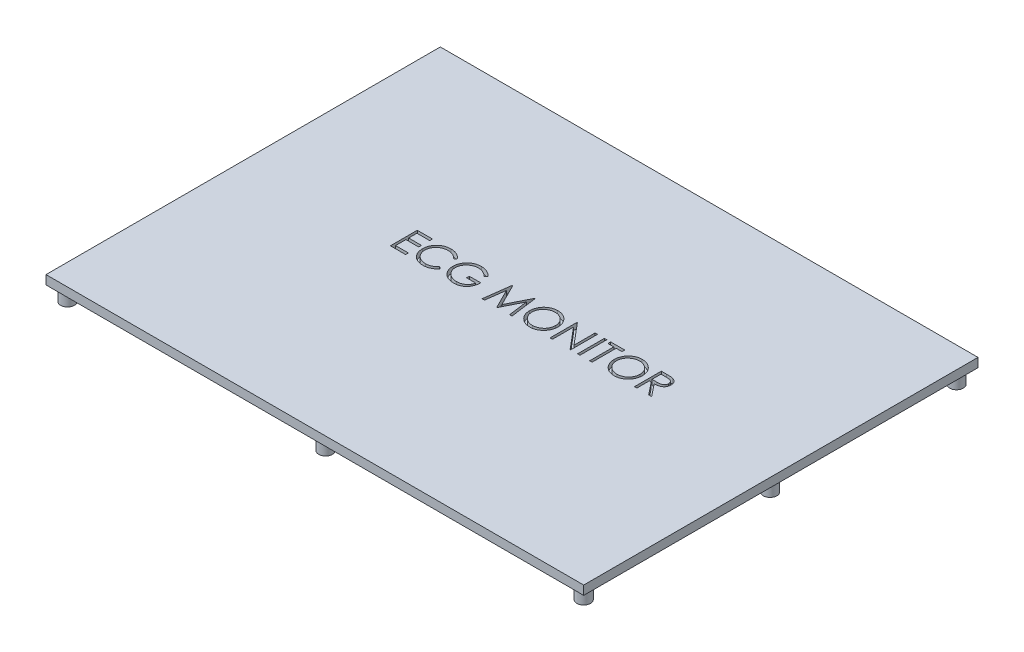
from build123d import *

# Parameters (mm, degrees)
SKETCH1_W           = 150
SKETCH1_H           = 110
BOSS_EXTRUDE1_DEPTH = 2.5
SKETCH2_R           = 1.9
BOSS_EXTRUDE2_DEPTH = 4
SKETCH3_W           = 0.673076923
SKETCH3_H           = 7.5
CUT_EXTRUDE1_DEPTH  = 1.5


with BuildPart() as part:
    # Sketch1 → Boss-Extrude1 (new body)
    with BuildSketch(Plane(origin=(0, 0, 0), x_dir=(1, 0, 0), z_dir=(0, 1, 0))):
        Rectangle(SKETCH1_W, SKETCH1_H)
    extrude(amount=BOSS_EXTRUDE1_DEPTH)

    # Sketch2 → Boss-Extrude2 (add)
    with BuildSketch(Plane.XZ):
        with Locations(Location((-72, 52, 0), (0, 0, 90))):
            Circle(SKETCH2_R)
        with Locations(Location((0, 52, 0), (0, 0, 90))):
            Circle(SKETCH2_R)
        with Locations(Location((72, 52, 0), (0, 0, 90))):
            Circle(SKETCH2_R)
        with Locations(Location((72, 0, 0), (0, 0, 90))):
            Circle(SKETCH2_R)
        with Locations(Location((72, -52, 0), (0, 0, 90))):
            Circle(SKETCH2_R)
        with Locations(Location((0, -52, 0), (0, 0, 90))):
            Circle(SKETCH2_R)
        with Locations(Location((-72, -52, 0), (0, 0, 90))):
            Circle(SKETCH2_R)
        with Locations(Location((-72, 0, 0), (0, 0, 90))):
            Circle(SKETCH2_R)
    extrude(amount=BOSS_EXTRUDE2_DEPTH)

    # Sketch3 → Cut-Extrude1 (cut)
    # profile 1 of 10: a face of its own
    with BuildSketch(Plane(origin=(0, 2.5, 0), x_dir=(1, 0, 0), z_dir=(0, 1, 0))):
        Polygon((-33.920536471, 7.5), (-29.68976724, 7.5), (-29.68976724, 6.730769231), (-33.247459547, 6.730769231), (-33.247459547, 4.423076923), (-29.68976724, 4.423076923), (-29.68976724, 3.653846154), (-33.247459547, 3.653846154), (-33.247459547, 0.769230769), (-29.68976724, 0.769230769), (-29.68976724, 0), (-33.920536471, 0), align=None)
    # profile 2 of 10: a face of its own
    with BuildSketch(Plane(origin=(0, 2.5, 0), x_dir=(1, 0, 0), z_dir=(0, 1, 0))):
        with BuildLine():
            Line((-21.420536471, 6.123798077), (-22.009478778, 5.673076923))
            add(Edge.make_bspline(
                [(-22.009478778, 5.673076923), (-22.051491396, 5.723146858), (-22.134950211, 5.822611678), (-22.26921993, 5.96228213), (-22.409152022, 6.093136262), (-22.554692996, 6.215797433), (-22.708462538, 6.325976216), (-22.866735678, 6.429414294), (-23.032160061, 6.522130875), (-23.260913778, 6.63455156), (-23.560159167, 6.751864749), (-23.936862394, 6.850228816), (-24.330100462, 6.912845621), (-24.598381032, 6.919627424), (-24.734839355, 6.923076923)],
                knots=[0, 0, 0, 0, 0.757959112, 1.505699292, 2.245454638, 2.979532153, 3.711538275, 4.438200793, 5.171680507, 5.909471876, 7.393775596, 8.890124382, 10.418191784, 12, 12, 12, 12], degree=3))
            add(Edge.make_bspline(
                [(-24.734839355, 6.923076923), (-24.810017854, 6.922211289), (-24.959677124, 6.920488055), (-25.181780995, 6.897754215), (-25.399737533, 6.865801622), (-25.613404961, 6.818390216), (-25.822511301, 6.758448889), (-26.028423591, 6.686823002), (-26.22816059, 6.598205488), (-26.424485387, 6.500259217), (-26.612583696, 6.389628978), (-26.790558798, 6.26895751), (-26.957761587, 6.13959516), (-27.114324327, 6.001057075), (-27.260407073, 5.85396716), (-27.394951311, 5.696757856), (-27.517491476, 5.52993177), (-27.630456529, 5.355688754), (-27.731626672, 5.174536343), (-27.816333557, 4.98580405), (-27.891344533, 4.792723829), (-27.950700053, 4.593114198), (-27.99768116, 4.3883797), (-28.030097582, 4.177970869), (-28.052572877, 3.96232727), (-28.054287542, 3.816164457), (-28.055151855, 3.742487981)],
                knots=[0, 0, 0, 0, 1.054917814, 2.100044995, 3.131103042, 4.146048494, 5.169673617, 6.183595914, 7.203665975, 8.234915748, 9.262203917, 10.264457458, 11.251630812, 12.227803204, 13.197192746, 14.159520551, 15.12972552, 16.100847026, 17.073214652, 18.039054194, 19.002613845, 19.979014051, 20.95965708, 21.949030935, 22.966165397, 24, 24, 24, 24], degree=3))
            add(Edge.make_bspline(
                [(-28.055151855, 3.742487981), (-28.052447957, 3.631635152), (-28.047139212, 3.413990328), (-27.999892782, 3.095196162), (-27.928096158, 2.789794718), (-27.82049135, 2.499695056), (-27.68780767, 2.221320003), (-27.520149217, 1.959379603), (-27.325970923, 1.709915536), (-27.102525738, 1.478823505), (-26.857370418, 1.267722666), (-26.594339179, 1.081828562), (-26.314087134, 0.9268681), (-26.019708641, 0.797919643), (-25.708938397, 0.698798084), (-25.382335249, 0.629017819), (-25.040609544, 0.583498861), (-24.807103688, 0.579140958), (-24.688264836, 0.576923077)],
                knots=[0, 0, 0, 0, 1.029171465, 2.020641659, 2.987623507, 3.938342917, 4.889210282, 5.84687017, 6.821220943, 7.821438502, 8.827599549, 9.822697543, 10.807740252, 11.797342354, 12.80366471, 13.83203677, 14.896651826, 16, 16, 16, 16], degree=3))
            add(Edge.make_bspline(
                [(-24.688264836, 0.576923077), (-24.557330502, 0.580541891), (-24.299620412, 0.587664582), (-23.921688927, 0.64800583), (-23.559898, 0.745844225), (-23.214228172, 0.882768345), (-22.88565393, 1.06076539), (-22.573661087, 1.276546556), (-22.277986293, 1.532164412), (-22.100190688, 1.727342544), (-22.009478778, 1.826923077)],
                knots=[0, 0, 0, 0, 1.028121516, 2.023589091, 2.998037872, 3.967518031, 4.937445131, 5.927275754, 6.942489185, 8, 8, 8, 8], degree=3))
            Line((-22.009478778, 1.826923077), (-21.420536471, 1.380709135))
            add(Edge.make_bspline(
                [(-21.420536471, 1.380709135), (-21.46793242, 1.319555309), (-21.562497296, 1.197540581), (-21.715621618, 1.025529775), (-21.876930112, 0.863735413), (-22.04762092, 0.713461939), (-22.225730473, 0.57170237), (-22.414456857, 0.44248416), (-22.611319069, 0.324003694), (-22.815650095, 0.215517427), (-23.027232837, 0.119266183), (-23.245813769, 0.036865252), (-23.470450717, -0.034116654), (-23.701153949, -0.092513661), (-23.938401999, -0.138094555), (-24.181338729, -0.168565287), (-24.430488462, -0.189440818), (-24.598577222, -0.191343495), (-24.683757624, -0.192307692)],
                knots=[0, 0, 0, 0, 0.986787822, 1.968848986, 2.935600012, 3.899624008, 4.868462664, 5.837806735, 6.815139263, 7.798259679, 8.787526145, 9.778297419, 10.776456485, 11.791383307, 12.812564526, 13.85620153, 14.913611965, 16, 16, 16, 16], degree=3))
            add(Edge.make_bspline(
                [(-24.683757624, -0.192307692), (-24.764422625, -0.19174628), (-24.923927675, -0.190636156), (-25.159425, -0.17265294), (-25.388688388, -0.148117789), (-25.611062586, -0.111174651), (-25.827761104, -0.067579637), (-26.036819499, -0.00914123), (-26.24029495, 0.05632127), (-26.437369966, 0.133260527), (-26.62821218, 0.220080918), (-26.812206061, 0.318205687), (-26.989266988, 0.426809683), (-27.161135747, 0.543498991), (-27.325273426, 0.672021781), (-27.483102409, 0.810593141), (-27.635507715, 0.958746021), (-27.729799183, 1.065577849), (-27.777207144, 1.119290865)],
                knots=[0, 0, 0, 0, 1.114604814, 2.203992996, 3.262667896, 4.300477797, 5.318619304, 6.316056647, 7.298880507, 8.271930387, 9.238335007, 10.195173496, 11.151986948, 12.108099108, 13.064862484, 14.031167946, 15.010108607, 16, 16, 16, 16], degree=3))
            add(Edge.make_bspline(
                [(-27.777207144, 1.119290865), (-27.853140665, 1.212593413), (-28.004090973, 1.398072078), (-28.197217438, 1.698684895), (-28.362533627, 2.012545343), (-28.496196315, 2.341302333), (-28.600687886, 2.684218163), (-28.673076161, 3.041465694), (-28.720115313, 3.412711284), (-28.725494504, 3.665218688), (-28.728228778, 3.793569712)],
                knots=[0, 0, 0, 0, 0.994628077, 1.977248131, 2.950237994, 3.925870899, 4.908910175, 5.911660606, 6.938484602, 8, 8, 8, 8], degree=3))
            add(Edge.make_bspline(
                [(-28.728228778, 3.793569712), (-28.724896221, 3.928474255), (-28.718339622, 4.193890522), (-28.662634346, 4.583406136), (-28.573022639, 4.956587705), (-28.445743592, 5.312738586), (-28.284374982, 5.653732044), (-28.085032239, 5.976963197), (-27.850031219, 6.284499196), (-27.581215003, 6.571673663), (-27.286427856, 6.83425799), (-26.970744683, 7.065271284), (-26.634783368, 7.257523104), (-26.282245115, 7.418229167), (-25.910490083, 7.541753016), (-25.520311435, 7.62822413), (-25.112442332, 7.682046522), (-24.834165705, 7.688850539), (-24.692772047, 7.692307692)],
                knots=[0, 0, 0, 0, 1.032925535, 2.032216505, 3.007276963, 3.968222605, 4.92396291, 5.891752235, 6.871517503, 7.883894988, 8.900124299, 9.891468569, 10.874487609, 11.85992873, 12.854644235, 13.869047385, 14.917252991, 16, 16, 16, 16], degree=3))
            add(Edge.make_bspline(
                [(-24.692772047, 7.692307692), (-24.606598179, 7.691274539), (-24.436025685, 7.689229516), (-24.183698572, 7.669287783), (-23.938036443, 7.636044341), (-23.698870053, 7.59079562), (-23.465035876, 7.534637074), (-23.238321074, 7.461479292), (-23.017395316, 7.377829582), (-22.803651942, 7.281490012), (-22.598116477, 7.173346995), (-22.400852937, 7.05459923), (-22.21342824, 6.925393933), (-22.034523565, 6.786829985), (-21.867131684, 6.63597593), (-21.706499944, 6.476981081), (-21.558083348, 6.305265744), (-21.466469359, 6.184398028), (-21.420536471, 6.123798077)],
                knots=[0, 0, 0, 0, 1.096760587, 2.17092713, 3.219439832, 4.250915756, 5.268269357, 6.278326846, 7.281116186, 8.274029601, 9.260640565, 10.235837813, 11.203064059, 12.156899882, 13.114053108, 14.069676657, 15.032185724, 16, 16, 16, 16], degree=3))
        make_face()
    # profile 3 of 10: a face of its own
    with BuildSketch(Plane(origin=(0, 2.5, 0), x_dir=(1, 0, 0), z_dir=(0, 1, 0))):
        with BuildLine():
            Line((-12.862844163, 6.219951923), (-13.43976724, 5.673076923))
            add(Edge.make_bspline(
                [(-13.43976724, 5.673076923), (-13.544164857, 5.771285915), (-13.750470671, 5.96536205), (-14.086814048, 6.217171325), (-14.437736121, 6.432884397), (-14.801405757, 6.608397761), (-15.168816944, 6.748439391), (-15.535092893, 6.848142548), (-15.896476539, 6.911726557), (-16.136834864, 6.919330206), (-16.255272047, 6.923076923)],
                knots=[0, 0, 0, 0, 1.08915593, 2.152340314, 3.188132944, 4.216796309, 5.218260357, 6.173443236, 7.099959455, 8, 8, 8, 8], degree=3))
            add(Edge.make_bspline(
                [(-16.255272047, 6.923076923), (-16.327946404, 6.922190625), (-16.473106634, 6.920420327), (-16.688725086, 6.89782558), (-16.902082165, 6.865329442), (-17.112775111, 6.818311133), (-17.321213582, 6.758720291), (-17.526672637, 6.684180013), (-17.72953554, 6.597275918), (-17.927891428, 6.496856332), (-18.120192507, 6.386542375), (-18.301814297, 6.264295502), (-18.473914438, 6.13403381), (-18.633258206, 5.992495996), (-18.780762178, 5.840964142), (-18.91993726, 5.682257058), (-19.045888609, 5.512038732), (-19.159655391, 5.333440962), (-19.261144573, 5.149600557), (-19.350734545, 4.962287007), (-19.425942591, 4.772121605), (-19.485448567, 4.578865724), (-19.534542825, 4.38401446), (-19.569080555, 4.186218631), (-19.588552102, 3.985266448), (-19.591920202, 3.850700894), (-19.593613394, 3.783052885)],
                knots=[0, 0, 0, 0, 1.02818874, 2.053710826, 3.065248034, 4.081641283, 5.106893873, 6.131558223, 7.173050175, 8.228653731, 9.27666206, 10.308777013, 11.325269123, 12.329503258, 13.32196095, 14.316845687, 15.314881793, 16.315733098, 17.311955233, 18.285320748, 19.252783886, 20.203351036, 21.145449891, 22.095197417, 23.042428769, 24, 24, 24, 24], degree=3))
            add(Edge.make_bspline(
                [(-19.593613394, 3.783052885), (-19.591993997, 3.713901133), (-19.588759627, 3.575786461), (-19.568058942, 3.369656306), (-19.529641284, 3.166587586), (-19.478281908, 2.965913016), (-19.414037303, 2.767288913), (-19.333953018, 2.571576392), (-19.23909816, 2.378782696), (-19.129305549, 2.190644946), (-19.008906541, 2.007381324), (-18.87402851, 1.834753778), (-18.730755832, 1.670463541), (-18.573868903, 1.518158333), (-18.408398456, 1.373764269), (-18.229400721, 1.241259579), (-18.040395449, 1.118091958), (-17.841094281, 1.005813702), (-17.633659747, 0.905509697), (-17.420966705, 0.816315634), (-17.202335671, 0.742859911), (-16.978915622, 0.682992545), (-16.750972897, 0.63392048), (-16.517350462, 0.602350879), (-16.279766087, 0.579441956), (-16.119611876, 0.577766949), (-16.038925894, 0.576923077)],
                knots=[0, 0, 0, 0, 0.93586088, 1.869166235, 2.799637598, 3.729985548, 4.670839027, 5.622275134, 6.589130586, 7.576015415, 8.568469353, 9.55398029, 10.53834874, 11.515998671, 12.510579167, 13.508179873, 14.527009472, 15.561807829, 16.601455013, 17.643573243, 18.680854198, 19.719860599, 20.772568776, 21.833555941, 22.908541556, 24, 24, 24, 24], degree=3))
            add(Edge.make_bspline(
                [(-16.038925894, 0.576923077), (-15.941686578, 0.57895574), (-15.750741384, 0.582947206), (-15.47005615, 0.614019254), (-15.200478141, 0.662548098), (-14.942764848, 0.733617876), (-14.696616947, 0.824268609), (-14.461132072, 0.933544437), (-14.238164232, 1.065636706), (-14.027043146, 1.214723564), (-13.832563463, 1.380826777), (-13.657161769, 1.560064895), (-13.50363572, 1.751567895), (-13.369697079, 1.954207856), (-13.25889282, 2.169662081), (-13.167943973, 2.396874715), (-13.098229777, 2.635947955), (-13.069611974, 2.801144309), (-13.055151855, 2.884615385)],
                knots=[0, 0, 0, 0, 1.13008108, 2.219097802, 3.278683437, 4.311054135, 5.322181354, 6.324827112, 7.324222904, 8.330512327, 9.32562643, 10.293043162, 11.24128371, 12.174520618, 13.111833804, 14.052305215, 15.015860969, 16, 16, 16, 16], degree=3))
            Line((-13.055151855, 2.884615385), (-15.555151855, 2.884615385))
            Line((-15.555151855, 2.884615385), (-15.555151855, 3.653846154))
            Line((-15.555151855, 3.653846154), (-12.382074932, 3.653846154))
            add(Edge.make_bspline(
                [(-12.382074932, 3.653846154), (-12.385730321, 3.510472964), (-12.392884579, 3.229865731), (-12.443067969, 2.820643722), (-12.524103353, 2.434132951), (-12.634804021, 2.069926369), (-12.778108193, 1.728540099), (-12.952477897, 1.409627528), (-13.160703871, 1.115248926), (-13.395369103, 0.843001061), (-13.658726155, 0.60015275), (-13.943658912, 0.386711454), (-14.25063813, 0.206920135), (-14.579373432, 0.060647287), (-14.928788646, -0.053511273), (-15.299692317, -0.134450366), (-15.691581462, -0.182943145), (-15.960160055, -0.189138958), (-16.097519644, -0.192307692)],
                knots=[0, 0, 0, 0, 1.140356446, 2.231883559, 3.274166699, 4.278491846, 5.25512956, 6.21435461, 7.1637429, 8.11826594, 9.068280886, 10.0076534, 10.945064095, 11.891975133, 12.864533718, 13.863980011, 14.907571808, 16, 16, 16, 16], degree=3))
            add(Edge.make_bspline(
                [(-16.097519644, -0.192307692), (-16.182184219, -0.191088147), (-16.34917005, -0.18868281), (-16.595793467, -0.171588494), (-16.83561694, -0.145272973), (-17.06860553, -0.105533423), (-17.295616263, -0.056859164), (-17.515515374, 0.005469519), (-17.729140536, 0.077616732), (-17.936821933, 0.159678889), (-18.136674534, 0.254761011), (-18.329588499, 0.360424524), (-18.516630197, 0.476124583), (-18.69652555, 0.603862109), (-18.870211882, 0.742681667), (-19.036569261, 0.892861493), (-19.196529, 1.053942464), (-19.296729993, 1.168326056), (-19.347219163, 1.225961538)],
                knots=[0, 0, 0, 0, 1.107784379, 2.184907829, 3.233506516, 4.263428166, 5.276301166, 6.270063455, 7.25232949, 8.225834625, 9.190232166, 10.146266622, 11.1027726, 12.066435141, 13.031522626, 14.010570082, 14.99756817, 16, 16, 16, 16], degree=3))
            add(Edge.make_bspline(
                [(-19.347219163, 1.225961538), (-19.420474731, 1.317398652), (-19.565769901, 1.498755117), (-19.752794523, 1.789326427), (-19.9122261, 2.090187556), (-20.041585719, 2.402176045), (-20.142595904, 2.725000073), (-20.215037874, 3.058247125), (-20.257482065, 3.402346334), (-20.263596788, 3.635200472), (-20.266690317, 3.753004808)],
                knots=[0, 0, 0, 0, 1.023165419, 2.029347347, 3.013907458, 3.994755782, 4.975994455, 5.96558838, 6.970761222, 8, 8, 8, 8], degree=3))
            add(Edge.make_bspline(
                [(-20.266690317, 3.753004808), (-20.265549806, 3.841218206), (-20.263283281, 4.016523865), (-20.235800032, 4.276789524), (-20.196368422, 4.532433864), (-20.138410448, 4.783247913), (-20.065347024, 5.029399182), (-19.974160982, 5.271001961), (-19.867993348, 5.508198829), (-19.744595856, 5.739357118), (-19.607272014, 5.961409431), (-19.458235828, 6.173461866), (-19.29537097, 6.37165272), (-19.121337114, 6.558491966), (-18.934057849, 6.731632353), (-18.735287656, 6.892676876), (-18.52487335, 7.041841559), (-18.302152964, 7.17677692), (-18.070450783, 7.297984678), (-17.830322209, 7.404247274), (-17.581840542, 7.492068665), (-17.326867376, 7.566583907), (-17.063472732, 7.621687779), (-16.79356801, 7.661649377), (-16.515746341, 7.688993519), (-16.32795485, 7.691192638), (-16.23273599, 7.692307692)],
                knots=[0, 0, 0, 0, 1.008945113, 2.00506715, 2.99143336, 3.967273523, 4.948097931, 5.927297278, 6.919902385, 7.919676788, 8.923139349, 9.905703106, 10.883022732, 11.856032218, 12.825136022, 13.798837087, 14.781400844, 15.773989409, 16.776158564, 17.77167057, 18.775803737, 19.789618931, 20.80898985, 21.851988756, 22.910860228, 24, 24, 24, 24], degree=3))
            add(Edge.make_bspline(
                [(-16.23273599, 7.692307692), (-16.15508261, 7.691065924), (-16.001105085, 7.688603644), (-15.771978515, 7.671536541), (-15.546393484, 7.644485367), (-15.324015506, 7.607570825), (-15.105601864, 7.557291488), (-14.890530352, 7.497123735), (-14.678489203, 7.42706983), (-14.470142955, 7.343522302), (-14.264090706, 7.248693105), (-14.059186762, 7.141950057), (-13.856131235, 7.021467905), (-13.654571989, 6.8868889), (-13.453238008, 6.740524433), (-13.255313774, 6.578188382), (-13.056021751, 6.406282477), (-12.927875006, 6.282677797), (-12.862844163, 6.219951923)],
                knots=[0, 0, 0, 0, 0.985871117, 1.954866573, 2.915460327, 3.869826059, 4.81536089, 5.759505086, 6.70452669, 7.649098992, 8.607881297, 9.583363685, 10.581137262, 11.603961102, 12.659522466, 13.73993555, 14.853081303, 16, 16, 16, 16], degree=3))
        make_face()
    # profile 4 of 10: a face of its own
    with BuildSketch(Plane(origin=(0, 2.5, 0), x_dir=(1, 0, 0), z_dir=(0, 1, 0))):
        Polygon((-8.343613394, 0), (-7.353529259, 7.5), (-7.257375413, 7.5), (-4.160921086, 1.346153846), (-1.071978778, 7.5), (-0.974322528, 7.5), (0.021771222, 0), (-0.654310509, 0), (-1.372459547, 5.396634615), (-4.079791278, 0), (-4.231534067, 0), (-6.949382624, 5.408653846), (-7.666029259, 0), align=None)
    # profile 5 of 10: a face of its own
    with BuildSketch(Plane(origin=(0, 2.5, 0), x_dir=(1, 0, 0), z_dir=(0, 1, 0))):
        with BuildLine():
            add(Edge.make_bspline(
                [(5.069848145, 7.692307692), (5.208722658, 7.688790237), (5.481483658, 7.681881663), (5.882358439, 7.62899787), (6.265062215, 7.537507748), (6.632712512, 7.4156585), (6.980911748, 7.253113389), (7.312280803, 7.056645214), (7.626031247, 6.824195659), (7.917934207, 6.557561602), (8.185056244, 6.2674542), (8.420397428, 5.957858679), (8.617630915, 5.63064696), (8.779600459, 5.286802323), (8.906668908, 4.927102391), (8.994352573, 4.549629528), (9.050362895, 4.156829478), (9.056910989, 3.888914768), (9.06023276, 3.753004808)],
                knots=[0, 0, 0, 0, 1.065120563, 2.091984664, 3.0946048, 4.079830382, 5.057816894, 6.036188127, 7.030412546, 8.04752943, 9.064399622, 10.05169764, 11.02544977, 11.989514704, 12.962713494, 13.945757189, 14.957906945, 16, 16, 16, 16], degree=3))
            add(Edge.make_bspline(
                [(9.06023276, 3.753004808), (9.056911476, 3.618095994), (9.050364841, 3.352175093), (8.994288889, 2.961867713), (8.906343889, 2.586673363), (8.780780461, 2.227218393), (8.619583008, 1.883123613), (8.421036212, 1.555294427), (8.187162189, 1.243623359), (7.921004651, 0.95152479), (7.630859561, 0.683673067), (7.319651847, 0.450275477), (6.994380447, 0.249438067), (6.650859644, 0.089187337), (6.293645279, -0.03889535), (5.919540301, -0.126222414), (5.530297685, -0.182551793), (5.26485982, -0.189020041), (5.129944299, -0.192307692)],
                knots=[0, 0, 0, 0, 1.043624062, 2.057103931, 3.04512605, 4.022047818, 4.998200453, 5.980619268, 6.982898556, 8.009068085, 9.034988726, 10.034168286, 11.015286542, 11.987931943, 12.962482838, 13.94673481, 14.956375938, 16, 16, 16, 16], degree=3))
            add(Edge.make_bspline(
                [(5.129944299, -0.192307692), (4.994035044, -0.188987578), (4.726121724, -0.182442748), (4.332828077, -0.126339737), (3.955090054, -0.038608372), (3.593987873, 0.086768991), (3.249320167, 0.248805914), (2.920412847, 0.446386726), (2.608586103, 0.6808306), (2.316425217, 0.946901832), (2.049105507, 1.236555157), (1.816049702, 1.546914275), (1.618424459, 1.871890254), (1.456931604, 2.212384948), (1.329079191, 2.566752326), (1.24185458, 2.937356206), (1.185420397, 3.322083718), (1.178917155, 3.584032786), (1.175617376, 3.716947115)],
                knots=[0, 0, 0, 0, 1.053102029, 2.075944431, 3.073151272, 4.055350789, 5.033113405, 6.020478099, 7.024410459, 8.052272461, 9.079885166, 10.07527673, 11.055994387, 12.023226415, 12.992069828, 13.970394897, 14.97016774, 16, 16, 16, 16], degree=3))
            add(Edge.make_bspline(
                [(1.175617376, 3.716947115), (1.176763023, 3.806159978), (1.179039865, 3.983460242), (1.206450635, 4.246745814), (1.246225709, 4.505797224), (1.303229807, 4.759877827), (1.377783379, 5.008365651), (1.465752009, 5.252974428), (1.573194535, 5.491225265), (1.694653067, 5.724246819), (1.830214084, 5.948406617), (1.979947833, 6.160291438), (2.138595051, 6.361679288), (2.312516609, 6.547351439), (2.49598042, 6.722709274), (2.691962659, 6.885057954), (2.899267468, 7.03586142), (3.118786853, 7.171762151), (3.345111728, 7.294674582), (3.578419109, 7.400149977), (3.815540334, 7.490677252), (4.057586008, 7.564050449), (4.303913376, 7.62197624), (4.555060058, 7.661420569), (4.810825971, 7.688901251), (4.98313594, 7.691167326), (5.069848145, 7.692307692)],
                knots=[0, 0, 0, 0, 1.037015668, 2.060948919, 3.074880161, 4.083647147, 5.086022904, 6.090072063, 7.104153813, 8.122640571, 9.144368836, 10.147691507, 11.138137339, 12.123020368, 13.103399296, 14.087645067, 15.080126199, 16.082011238, 17.087798457, 18.072939717, 19.057185487, 20.037253025, 21.01195951, 21.997135196, 22.992090687, 24, 24, 24, 24], degree=3))
        make_face()
        with BuildLine():
            add(Edge.make_bspline(
                [(5.102901029, 6.923076923), (5.031726815, 6.922209301), (4.890058816, 6.920482352), (4.679449095, 6.89773439), (4.471609237, 6.865313199), (4.266496318, 6.819067083), (4.064968555, 6.756058399), (3.865147467, 6.683542167), (3.668855208, 6.595211258), (3.476739799, 6.495412606), (3.290493209, 6.384950633), (3.114751706, 6.262868275), (2.949060326, 6.132028516), (2.793824755, 5.992126007), (2.649500814, 5.842448289), (2.513247883, 5.685264498), (2.390527351, 5.516081874), (2.278058257, 5.339488145), (2.177412885, 5.155713328), (2.087915697, 4.966692195), (2.014707106, 4.770882866), (1.955002014, 4.570409671), (1.90550242, 4.365590115), (1.874144011, 4.154870438), (1.851146098, 3.939309484), (1.849517858, 3.793634083), (1.848694299, 3.719951923)],
                knots=[0, 0, 0, 0, 1.008559885, 2.007477868, 2.99961109, 3.989939068, 4.984837346, 5.991145699, 7.001802488, 8.033829008, 9.059044045, 10.069351652, 11.065060232, 12.050310815, 13.029377138, 14.011219647, 14.996725999, 15.989392538, 16.977580475, 17.965360261, 18.951710183, 19.937753436, 20.929683414, 21.935841486, 22.955955122, 24, 24, 24, 24], degree=3))
            add(Edge.make_bspline(
                [(1.848694299, 3.719951923), (1.851426146, 3.611604307), (1.856800534, 3.398451028), (1.90385247, 3.08609072), (1.97632813, 2.785901535), (2.083165343, 2.499526015), (2.216773803, 2.224502551), (2.381831425, 1.963270899), (2.577386609, 1.715760454), (2.799522737, 1.483699163), (3.042357108, 1.271886725), (3.300212958, 1.085965135), (3.570327831, 0.928657457), (3.853406123, 0.800503731), (4.147936564, 0.698954292), (4.45581703, 0.629357226), (4.774996587, 0.583552678), (4.992562276, 0.579153916), (5.102901029, 0.576923077)],
                knots=[0, 0, 0, 0, 1.032063989, 2.030389145, 3.003944642, 3.970395727, 4.937377036, 5.913328081, 6.909231446, 7.93887556, 8.970685674, 9.976071282, 10.964166581, 11.944589148, 12.933237628, 13.927779006, 14.949070134, 16, 16, 16, 16], degree=3))
            add(Edge.make_bspline(
                [(5.102901029, 0.576923077), (5.177064247, 0.577942015), (5.324152182, 0.579962875), (5.542928302, 0.600317182), (5.757763041, 0.632956902), (5.968355069, 0.679951164), (6.174465379, 0.738766607), (6.376954243, 0.80864031), (6.573664865, 0.895814318), (6.767078804, 0.992131357), (6.952213607, 1.101931694), (7.128946891, 1.219870586), (7.29282399, 1.350517631), (7.447943429, 1.488341515), (7.592859906, 1.636121189), (7.726593443, 1.793664521), (7.848693726, 1.96196593), (7.961120112, 2.138291799), (8.061412818, 2.322569483), (8.148796602, 2.512275936), (8.222931135, 2.706944028), (8.282777931, 2.906854538), (8.329675349, 3.111627785), (8.361989463, 3.321537953), (8.384593261, 3.536165115), (8.386296997, 3.681330521), (8.387155837, 3.754507212)],
                knots=[0, 0, 0, 0, 1.047197238, 2.076906641, 3.100256066, 4.114471768, 5.12198147, 6.126382909, 7.136867548, 8.15857795, 9.17633901, 10.174870724, 11.156907918, 12.133735059, 13.104061851, 14.077631395, 15.04955518, 16.038496417, 17.029181396, 18.010275684, 18.986308667, 19.968651475, 20.955262928, 21.950658345, 22.966943676, 24, 24, 24, 24], degree=3))
            add(Edge.make_bspline(
                [(8.387155837, 3.754507212), (8.386296309, 3.827183292), (8.384591278, 3.971349685), (8.362000261, 4.18448001), (8.32964121, 4.392879749), (8.283006835, 4.595730756), (8.222899363, 4.793084738), (8.148783655, 4.98475634), (8.061386585, 5.171459615), (7.961083247, 5.352733109), (7.848335054, 5.526678976), (7.725133104, 5.69296986), (7.589350215, 5.848482877), (7.444865876, 5.997057222), (7.288071122, 6.135524128), (7.119676206, 6.263929529), (6.941725468, 6.38537226), (6.753309963, 6.494927035), (6.558858634, 6.596100391), (6.359328724, 6.682781112), (6.156980653, 6.756435654), (5.952328984, 6.819257722), (5.743651173, 6.865132072), (5.532357254, 6.897763607), (5.318739557, 6.920474434), (5.175075515, 6.922206674), (5.102901029, 6.923076923)],
                knots=[0, 0, 0, 0, 1.02996197, 2.043119294, 3.035359645, 4.018872909, 4.991431989, 5.957985074, 6.929999688, 7.912076566, 8.892894881, 9.867085534, 10.843653904, 11.817741046, 12.803660682, 13.806313499, 14.818574707, 15.856120519, 16.894564902, 17.924820532, 18.937903209, 19.946497019, 20.957711757, 21.963978472, 22.977135795, 24, 24, 24, 24], degree=3))
        make_face(mode=Mode.SUBTRACT)
    # profile 6 of 10: a face of its own
    with BuildSketch(Plane(origin=(0, 2.5, 0), x_dir=(1, 0, 0), z_dir=(0, 1, 0))):
        Polygon((10.598694299, 0), (10.598694299, 7.5), (10.73992026, 7.5), (15.694848145, 1.597055288), (15.694848145, 7.5), (16.367925068, 7.5), (16.367925068, 0), (16.214679876, 0), (11.271771222, 5.889423077), (11.271771222, 0), align=None)
    # profile 7 of 10: a face of its own
    with BuildSketch(Plane(origin=(0, 2.5, 0), x_dir=(1, 0, 0), z_dir=(0, 1, 0))):
        with Locations((18.627540452, 3.75)):
            Rectangle(SKETCH3_W, SKETCH3_H)
    # profile 8 of 10: a face of its own
    with BuildSketch(Plane(origin=(0, 2.5, 0), x_dir=(1, 0, 0), z_dir=(0, 1, 0))):
        Polygon((20.021771222, 6.730769231), (20.021771222, 7.5), (23.964078914, 7.5), (23.964078914, 6.730769231), (22.329463529, 6.730769231), (22.329463529, 0), (21.656386606, 0), (21.656386606, 6.730769231), align=None)
    # profile 9 of 10: a face of its own
    with BuildSketch(Plane(origin=(0, 2.5, 0), x_dir=(1, 0, 0), z_dir=(0, 1, 0))):
        with BuildLine():
            add(Edge.make_bspline(
                [(28.627540453, 7.692307692), (28.766414965, 7.688790237), (29.039175966, 7.681881663), (29.440050747, 7.62899787), (29.822754522, 7.537507748), (30.19040482, 7.4156585), (30.538604055, 7.253113389), (30.869973111, 7.056645214), (31.183723554, 6.824195659), (31.475626515, 6.557561602), (31.742748551, 6.2674542), (31.978089736, 5.957858679), (32.175323223, 5.63064696), (32.337292767, 5.286802323), (32.464361216, 4.927102391), (32.552044881, 4.549629528), (32.608055203, 4.156829478), (32.614603297, 3.888914768), (32.617925068, 3.753004808)],
                knots=[0, 0, 0, 0, 1.065120563, 2.091984664, 3.0946048, 4.079830382, 5.057816894, 6.036188127, 7.030412546, 8.04752943, 9.064399622, 10.05169764, 11.02544977, 11.989514704, 12.962713494, 13.945757189, 14.957906945, 16, 16, 16, 16], degree=3))
            add(Edge.make_bspline(
                [(32.617925068, 3.753004808), (32.614603784, 3.618095994), (32.608057148, 3.352175093), (32.551981197, 2.961867713), (32.464036197, 2.586673363), (32.338472769, 2.227218393), (32.177275315, 1.883123613), (31.97872852, 1.555294427), (31.744854497, 1.243623359), (31.478696959, 0.95152479), (31.188551869, 0.683673067), (30.877344154, 0.450275477), (30.552072755, 0.249438067), (30.208551951, 0.089187337), (29.851337587, -0.03889535), (29.477232609, -0.126222414), (29.087989993, -0.182551793), (28.822552128, -0.189020041), (28.687636606, -0.192307692)],
                knots=[0, 0, 0, 0, 1.043624062, 2.057103931, 3.04512605, 4.022047818, 4.998200453, 5.980619268, 6.982898556, 8.009068085, 9.034988726, 10.034168286, 11.015286542, 11.987931943, 12.962482838, 13.94673481, 14.956375938, 16, 16, 16, 16], degree=3))
            add(Edge.make_bspline(
                [(28.687636606, -0.192307692), (28.551727351, -0.188987578), (28.283814032, -0.182442748), (27.890520384, -0.126339737), (27.512782362, -0.038608372), (27.151680181, 0.086768991), (26.807012474, 0.248805914), (26.478105154, 0.446386726), (26.16627841, 0.6808306), (25.874117525, 0.946901832), (25.606797814, 1.236555157), (25.373742009, 1.546914275), (25.176116767, 1.871890254), (25.014623911, 2.212384948), (24.886771498, 2.566752326), (24.799546888, 2.937356206), (24.743112705, 3.322083718), (24.736609463, 3.584032786), (24.733309683, 3.716947115)],
                knots=[0, 0, 0, 0, 1.053102029, 2.075944431, 3.073151272, 4.055350789, 5.033113405, 6.020478099, 7.024410459, 8.052272461, 9.079885166, 10.07527673, 11.055994387, 12.023226415, 12.992069828, 13.970394897, 14.97016774, 16, 16, 16, 16], degree=3))
            add(Edge.make_bspline(
                [(24.733309683, 3.716947115), (24.734455331, 3.806159978), (24.736732173, 3.983460242), (24.764142943, 4.246745814), (24.803918017, 4.505797224), (24.860922115, 4.759877827), (24.935475687, 5.008365651), (25.023444317, 5.252974428), (25.130886843, 5.491225265), (25.252345374, 5.724246819), (25.387906392, 5.948406617), (25.53764014, 6.160291438), (25.696287359, 6.361679288), (25.870208916, 6.547351439), (26.053672727, 6.722709274), (26.249654966, 6.885057954), (26.456959776, 7.03586142), (26.676479161, 7.171762151), (26.902804036, 7.294674582), (27.136111417, 7.400149977), (27.373232641, 7.490677252), (27.615278315, 7.564050449), (27.861605684, 7.62197624), (28.112752365, 7.661420569), (28.368518279, 7.688901251), (28.540828248, 7.691167326), (28.627540453, 7.692307692)],
                knots=[0, 0, 0, 0, 1.037015668, 2.060948919, 3.074880161, 4.083647147, 5.086022904, 6.090072063, 7.104153813, 8.122640571, 9.144368836, 10.147691507, 11.138137339, 12.123020368, 13.103399296, 14.087645067, 15.080126199, 16.082011238, 17.087798457, 18.072939717, 19.057185487, 20.037253025, 21.01195951, 21.997135196, 22.992090687, 24, 24, 24, 24], degree=3))
        make_face()
        with BuildLine():
            add(Edge.make_bspline(
                [(28.660593337, 6.923076923), (28.589419122, 6.922209301), (28.447751123, 6.920482352), (28.237141403, 6.89773439), (28.029301545, 6.865313199), (27.824188626, 6.819067083), (27.622660863, 6.756058399), (27.422839774, 6.683542167), (27.226547516, 6.595211258), (27.034432106, 6.495412606), (26.848185517, 6.384950633), (26.672444014, 6.262868275), (26.506752634, 6.132028516), (26.351517062, 5.992126007), (26.207193122, 5.842448289), (26.07094019, 5.685264498), (25.948219658, 5.516081874), (25.835750565, 5.339488145), (25.735105193, 5.155713328), (25.645608004, 4.966692195), (25.572399414, 4.770882866), (25.512694322, 4.570409671), (25.463194727, 4.365590115), (25.431836319, 4.154870438), (25.408838405, 3.939309484), (25.407210165, 3.793634083), (25.406386606, 3.719951923)],
                knots=[0, 0, 0, 0, 1.008559885, 2.007477868, 2.99961109, 3.989939068, 4.984837346, 5.991145699, 7.001802488, 8.033829008, 9.059044045, 10.069351652, 11.065060232, 12.050310815, 13.029377138, 14.011219647, 14.996725999, 15.989392538, 16.977580475, 17.965360261, 18.951710183, 19.937753436, 20.929683414, 21.935841486, 22.955955122, 24, 24, 24, 24], degree=3))
            add(Edge.make_bspline(
                [(25.406386606, 3.719951923), (25.409118453, 3.611604307), (25.414492842, 3.398451028), (25.461544778, 3.08609072), (25.534020437, 2.785901535), (25.640857651, 2.499526015), (25.774466111, 2.224502551), (25.939523733, 1.963270899), (26.135078916, 1.715760454), (26.357215045, 1.483699163), (26.600049416, 1.271886725), (26.857905266, 1.085965135), (27.128020139, 0.928657457), (27.411098431, 0.800503731), (27.705628871, 0.698954292), (28.013509338, 0.629357226), (28.332688894, 0.583552678), (28.550254584, 0.579153916), (28.660593337, 0.576923077)],
                knots=[0, 0, 0, 0, 1.032063989, 2.030389145, 3.003944642, 3.970395727, 4.937377036, 5.913328081, 6.909231446, 7.93887556, 8.970685674, 9.976071282, 10.964166581, 11.944589148, 12.933237628, 13.927779006, 14.949070134, 16, 16, 16, 16], degree=3))
            add(Edge.make_bspline(
                [(28.660593337, 0.576923077), (28.734756555, 0.577942015), (28.88184449, 0.579962875), (29.100620609, 0.600317182), (29.315455349, 0.632956902), (29.526047377, 0.679951164), (29.732157687, 0.738766607), (29.934646551, 0.80864031), (30.131357173, 0.895814318), (30.324771111, 0.992131357), (30.509905915, 1.101931694), (30.686639198, 1.219870586), (30.850516298, 1.350517631), (31.005635737, 1.488341515), (31.150552213, 1.636121189), (31.284285751, 1.793664521), (31.406386034, 1.96196593), (31.51881242, 2.138291799), (31.619105126, 2.322569483), (31.706488909, 2.512275936), (31.780623443, 2.706944028), (31.840470239, 2.906854538), (31.887367657, 3.111627785), (31.919681771, 3.321537953), (31.942285568, 3.536165115), (31.943989305, 3.681330521), (31.944848145, 3.754507212)],
                knots=[0, 0, 0, 0, 1.047197238, 2.076906641, 3.100256066, 4.114471768, 5.12198147, 6.126382909, 7.136867548, 8.15857795, 9.17633901, 10.174870724, 11.156907918, 12.133735059, 13.104061851, 14.077631395, 15.04955518, 16.038496417, 17.029181396, 18.010275684, 18.986308667, 19.968651475, 20.955262928, 21.950658345, 22.966943676, 24, 24, 24, 24], degree=3))
            add(Edge.make_bspline(
                [(31.944848145, 3.754507212), (31.943988617, 3.827183292), (31.942283585, 3.971349685), (31.919692568, 4.18448001), (31.887333517, 4.392879749), (31.840699143, 4.595730756), (31.780591671, 4.793084738), (31.706475963, 4.98475634), (31.619078893, 5.171459615), (31.518775555, 5.352733109), (31.406027361, 5.526678976), (31.282825411, 5.69296986), (31.147042523, 5.848482877), (31.002558184, 5.997057222), (30.845763429, 6.135524128), (30.677368513, 6.263929529), (30.499417775, 6.38537226), (30.311002271, 6.494927035), (30.116550941, 6.596100391), (29.917021031, 6.682781112), (29.714672961, 6.756435654), (29.510021292, 6.819257722), (29.301343481, 6.865132072), (29.090049562, 6.897763607), (28.876431865, 6.920474434), (28.732767823, 6.922206674), (28.660593337, 6.923076923)],
                knots=[0, 0, 0, 0, 1.02996197, 2.043119294, 3.035359645, 4.018872909, 4.991431989, 5.957985074, 6.929999688, 7.912076566, 8.892894881, 9.867085534, 10.843653904, 11.817741046, 12.803660682, 13.806313499, 14.818574707, 15.856120519, 16.894564902, 17.924820532, 18.937903209, 19.946497019, 20.957711757, 21.963978472, 22.977135795, 24, 24, 24, 24], degree=3))
        make_face(mode=Mode.SUBTRACT)
    # profile 10 of 10: a face of its own
    with BuildSketch(Plane(origin=(0, 2.5, 0), x_dir=(1, 0, 0), z_dir=(0, 1, 0))):
        with BuildLine():
            Line((34.156386606, 7.5), (35.657288049, 7.5))
            add(Edge.make_bspline(
                [(35.657288049, 7.5), (35.75744761, 7.499666601), (35.949765062, 7.499026439), (36.225279213, 7.495456947), (36.475622992, 7.485226185), (36.700665505, 7.476422078), (36.900402623, 7.460367918), (37.075446817, 7.445023674), (37.224991883, 7.424937258), (37.315518708, 7.40628278), (37.356506799, 7.397836538)],
                knots=[0, 0, 0, 0, 1.410062039, 2.707475311, 3.878576406, 4.937260626, 5.877586885, 6.699081471, 7.410979367, 8, 8, 8, 8], degree=3))
            add(Edge.make_bspline(
                [(37.356506799, 7.397836538), (37.411378136, 7.384279184), (37.519950256, 7.357453691), (37.676271827, 7.300754546), (37.825231092, 7.235141065), (37.966209287, 7.15807595), (38.098500268, 7.068987136), (38.223468077, 6.969412588), (38.341679784, 6.859897147), (38.448354706, 6.73767963), (38.548938388, 6.609458537), (38.633771159, 6.47080763), (38.70689933, 6.325818642), (38.765121867, 6.173017033), (38.812003238, 6.013884665), (38.845059466, 5.8469801), (38.864883439, 5.673063725), (38.866901701, 5.554439635), (38.867925068, 5.494290865)],
                knots=[0, 0, 0, 0, 1.027469482, 2.033020251, 3.019912614, 3.986113645, 4.951240523, 5.91722682, 6.890402269, 7.87763091, 8.8651537, 9.85103654, 10.82876324, 11.815024772, 12.821070561, 13.842952187, 14.906261191, 16, 16, 16, 16], degree=3))
            add(Edge.make_bspline(
                [(38.867925068, 5.494290865), (38.864777215, 5.394358498), (38.858634938, 5.199364567), (38.801366859, 4.916376964), (38.707560031, 4.652399861), (38.57829584, 4.407765637), (38.413682678, 4.187242826), (38.21584384, 3.993548993), (37.984668958, 3.831463466), (37.769463281, 3.719064599), (37.579361425, 3.647079795), (37.422861469, 3.596430454), (37.252146517, 3.557297671), (37.068852228, 3.522240246), (36.872215824, 3.49577233), (36.662708596, 3.47638677), (36.440181129, 3.464270951), (36.287311694, 3.462466655), (36.20867026, 3.461538462)],
                knots=[0, 0, 0, 0, 1.260483769, 2.459530307, 3.627416485, 4.787058657, 5.939039949, 7.08810263, 8.267026773, 9.491475466, 10.141966685, 10.831826277, 11.566392101, 12.351337768, 13.187381173, 14.07005841, 15.007169909, 16, 16, 16, 16], degree=3))
            Line((36.20867026, 3.461538462), (38.964078914, 0))
            Line((38.964078914, 0), (38.131747183, 0))
            Line((38.131747183, 0), (35.376338529, 3.461538462))
            Line((35.376338529, 3.461538462), (34.829463529, 3.461538462))
            Line((34.829463529, 3.461538462), (34.829463529, 0))
            Line((34.829463529, 0), (34.156386606, 0))
            Line((34.156386606, 0), (34.156386606, 7.5))
        make_face()
        with BuildLine():
            Line((34.829463529, 6.730769231), (34.829463529, 4.230769231))
            Line((34.829463529, 4.230769231), (36.202660645, 4.220252404))
            add(Edge.make_bspline(
                [(36.202660645, 4.220252404), (36.266775014, 4.22022404), (36.391046922, 4.220169062), (36.570834061, 4.228727154), (36.7382343, 4.238462835), (36.892607341, 4.25335429), (37.034022145, 4.272545872), (37.16240803, 4.296552267), (37.27797457, 4.324520973), (37.412757153, 4.367810171), (37.563264005, 4.436394496), (37.726831419, 4.536177707), (37.866122143, 4.661682963), (37.983803277, 4.805197511), (38.078366344, 4.962989473), (38.145035032, 5.133167407), (38.187340266, 5.311435117), (38.192330006, 5.433959634), (38.194848145, 5.495793269)],
                knots=[0, 0, 0, 0, 1.146690395, 2.22261258, 3.21895312, 4.145990853, 4.996080663, 5.770904154, 6.481378293, 7.121626537, 8.300444488, 9.431385265, 10.535395872, 11.636531494, 12.74115979, 13.810798291, 14.895190096, 16, 16, 16, 16], degree=3))
            add(Edge.make_bspline(
                [(38.194848145, 5.495793269), (38.192272171, 5.556107356), (38.187167531, 5.675627867), (38.145491599, 5.850604818), (38.075014353, 6.015748282), (37.980038129, 6.170386465), (37.864325654, 6.310755899), (37.728644626, 6.430856941), (37.576704923, 6.529962937), (37.434695212, 6.593293752), (37.307764757, 6.632122009), (37.197558342, 6.659445931), (37.073033747, 6.681398365), (36.933586336, 6.698987067), (36.779811413, 6.714104804), (36.610931446, 6.724287187), (36.428066917, 6.730316896), (36.301323493, 6.730614944), (36.235713529, 6.730769231)],
                knots=[0, 0, 0, 0, 1.101028733, 2.181837193, 3.264309656, 4.369019818, 5.486613113, 6.575447106, 7.666700264, 8.788928104, 9.402425223, 10.0903467, 10.862060571, 11.710948788, 12.657782767, 13.684531032, 14.801375019, 16, 16, 16, 16], degree=3))
            Line((36.235713529, 6.730769231), (34.829463529, 6.730769231))
        make_face(mode=Mode.SUBTRACT)
    extrude(amount=-CUT_EXTRUDE1_DEPTH, mode=Mode.SUBTRACT)


solid = part.part
